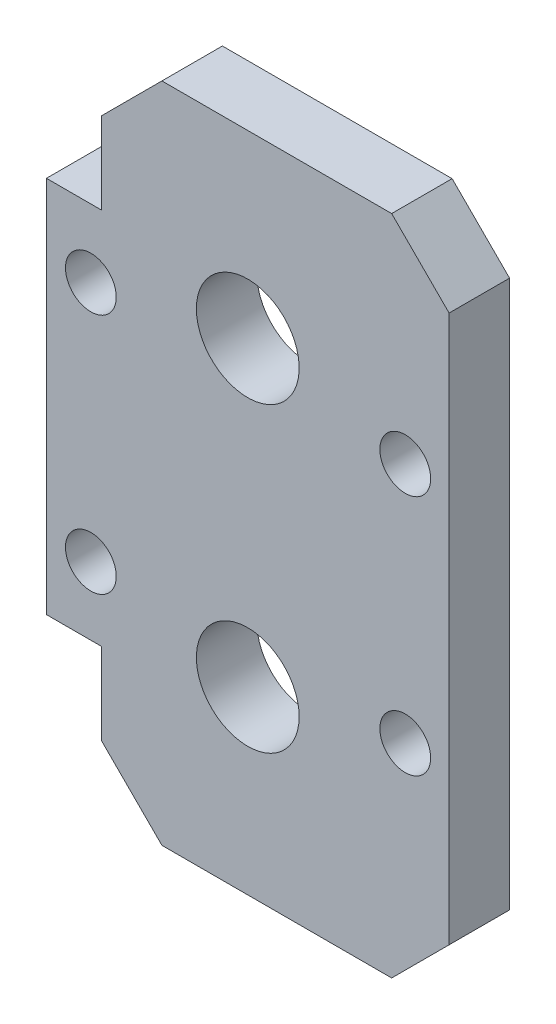
from build123d import *

# Parameters (mm, degrees)
SKETCH1_R           = 4.25
BOSS_EXTRUDE1_DEPTH = 5
SKETCH2_R           = 2.1
CUT_EXTRUDE1_DEPTH  = 10


with BuildPart() as part:
    # Sketch1 → Boss-Extrude1 (new body)
    with BuildSketch(Plane.XY):
        Polygon((11.900055679, -27.375), (16.650055679, -22.625), (16.650055679, 22.625), (11.900055679, 27.375), (-7.099944321, 27.375), (-12.099944321, 22.375), (-12.099944321, 15.625), (-16.65, 15.625), (-16.65, -15.625), (-12.099944321, -15.625), (-12.099944321, -22.375), (-7.099944321, -27.375), align=None)
        with Locations((0, -12.485)):
            Circle(SKETCH1_R, mode=Mode.SUBTRACT)
        with Locations(Location((0, 12.485, 0), (0, 0, 180))):
            Circle(SKETCH1_R, mode=Mode.SUBTRACT)
    extrude(amount=BOSS_EXTRUDE1_DEPTH)

    # Sketch2 → Cut-Extrude1 (cut)
    with BuildSketch(Plane(origin=(0, 0, 0), x_dir=(-1, 0, 0), z_dir=(0, 0, -1))):
        with Locations((-13.023685007, -10.001298691)):
            Circle(SKETCH2_R)
        with Locations((-13.023685007, 9.998690221)):
            Circle(SKETCH2_R)
        with Locations((12.976300579, -10.001298691)):
            Circle(SKETCH2_R)
        with Locations((12.976300579, 9.998690221)):
            Circle(SKETCH2_R)
    extrude(amount=-CUT_EXTRUDE1_DEPTH, mode=Mode.SUBTRACT)


solid = part.part
